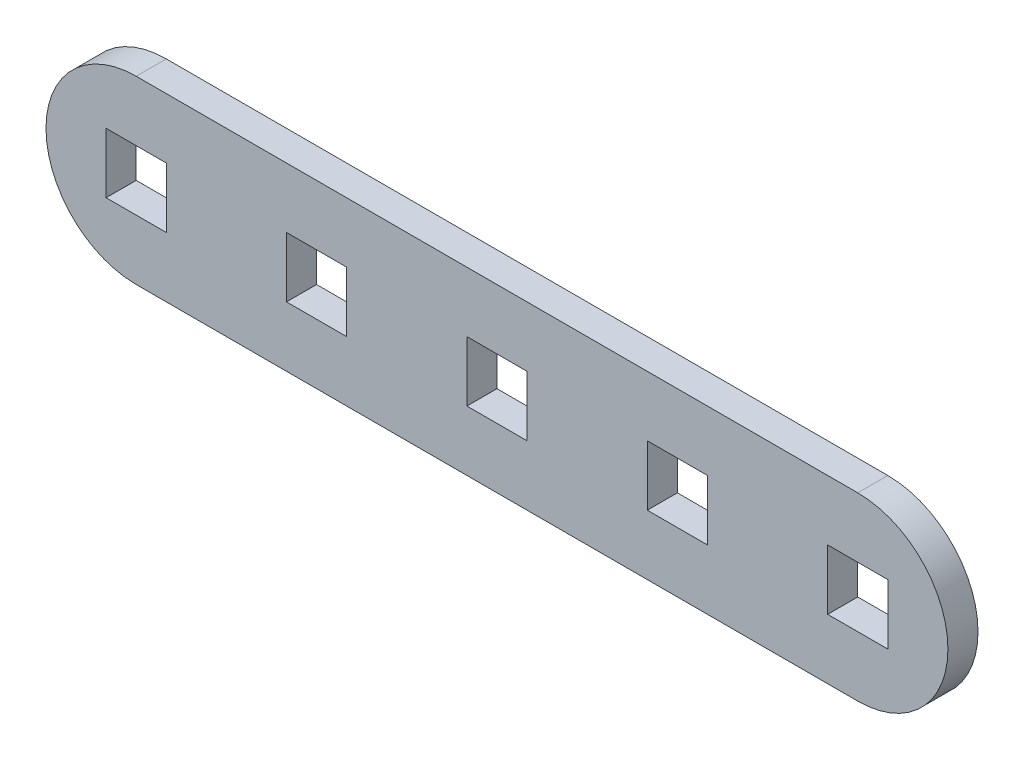
from build123d import *

# Parameters (mm, degrees)
MODEL_W                 = 3
MODEL_H                 = 3
SALIENTE_EXTRUIR1_DEPTH = 1.5


with BuildPart() as part:
    # Model → Saliente-Extruir1 (new body)
    with BuildSketch(Plane.XY):
        with BuildLine():
            Line((11.412749203, 297.239922936), (47.412749203, 297.239922936))
            ThreePointArc((47.412749203, 297.239922936), (51.912749203, 292.739922936), (47.412749203, 288.239922936))
            Line((47.412749203, 288.239922936), (11.412749203, 288.239922936))
            ThreePointArc((11.412749203, 288.239922936), (6.912749203, 292.739922936), (11.412749203, 297.239922936))
        make_face()
        with Locations((11.412749203, 292.739922936)):
            Rectangle(MODEL_W, MODEL_H, mode=Mode.SUBTRACT)
        with Locations((20.412749203, 292.739922936)):
            Rectangle(MODEL_W, MODEL_H, mode=Mode.SUBTRACT)
        with Locations((29.412749203, 292.739922936)):
            Rectangle(MODEL_W, MODEL_H, mode=Mode.SUBTRACT)
        with Locations((38.412749203, 292.739922936)):
            Rectangle(MODEL_W, MODEL_H, mode=Mode.SUBTRACT)
        with Locations((47.412749203, 292.739922936)):
            Rectangle(MODEL_W, MODEL_H, mode=Mode.SUBTRACT)
    extrude(amount=SALIENTE_EXTRUIR1_DEPTH)


solid = part.part
